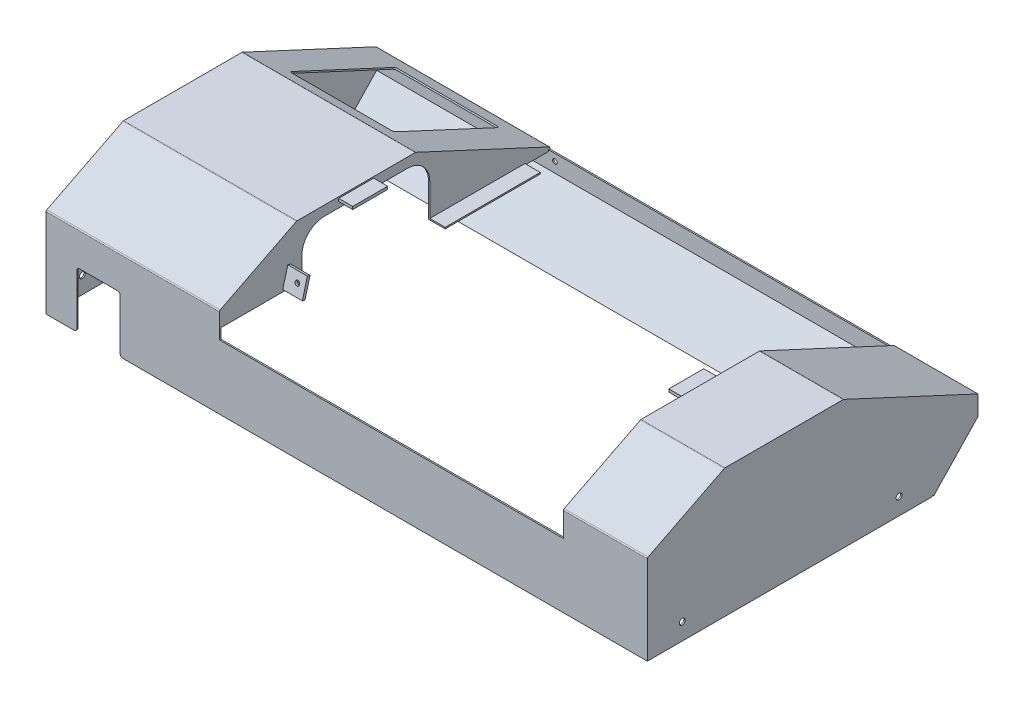
from build123d import *

# Parameters (mm, degrees)
EXTRUDE_1_DEPTH         = 215
EXTRUDE_2_DEPTH         = 1
EXTRUDE_3_DEPTH         = 1
SKETCH_4_W              = 246
SKETCH_4_H              = 137.991605588
CUT_EXTRUDE_1_DEPTH     = 333.555002245
CUT_EXTRUDE_2_REACH     = 274.801
SKETCH_5_W              = 74.6
SKETCH_5_H              = 83.6
FILLET_1_R              = 2
CUT_EXTRUDE_3_REACH     = 334.555
SKETCH_7_W              = 31
SKETCH_7_H              = 40
FILLET_2_R              = 2
FILLET_3_R              = 1
HOLE_WIZARD_M41_D       = 4.2
EXTRUDE_4_DEPTH         = 1
SKETCH_14_W             = 68
SKETCH_14_H             = 1
EXTRUDE_5_DEPTH         = 11
SKETCH_15_W             = 25
SKETCH_15_H             = 2
EXTRUDE_6_DEPTH         = 10
EXTRUDE_7_DEPTH         = 14
HOLE_WIZARD_M41_2_D     = 3.3
HOLE_WIZARD_M41_2_DEPTH = 1
HOLE_WIZARD_M42_D       = 3.3
HOLE_WIZARD_M42_DEPTH   = 2


with BuildPart() as part:
    # Эскиз1 → Бобышка-Вытянуть1 (new, symmetric)
    with BuildSketch(Plane(origin=(0, 0, 0), x_dir=(0, 0, -1), z_dir=(1, 0, 0))):
        Polygon((-97.817266744, 64), (-97.817266744, 0), (-96.817266744, 0), (-96.817266744, 63.385363703), (-42.261330955, 91), (42.278938578, 91), (137.622640037, 46.680562515), (137.622640037, 33.718332981), (106.182733256, 0.68946939), (106.907048077, 0), (138.622640037, 33.318481758), (138.622640037, 47.318481758), (42.5, 92), (-42.5, 92), align=None)
    extrude(amount=EXTRUDE_1_DEPTH, both=True)

    # Эскиз2 → Бобышка-Вытянуть2 (add)
    with BuildSketch(Plane(origin=(215, 0, 0), x_dir=(0, 0, -1), z_dir=(1, 0, 0))):
        Polygon((-96.817266744, 0), (-96.817266744, 63.385363703), (-42.261330955, 91), (42.278938578, 91), (137.622640037, 46.680562515), (137.622640037, 33.718332981), (105.526432948, 0), align=None)
    extrude(amount=-EXTRUDE_2_DEPTH)

    # Эскиз3 → Бобышка-Вытянуть3 (add)
    with BuildSketch(Plane.ZY.offset(215)):
        Polygon((96.817266744, 0), (96.817266744, 63.385363703), (42.261330955, 91), (-42.278938578, 91), (-137.622640037, 46.680562515), (-137.622640037, 33.718332981), (-105.526432948, 0), align=None)
    extrude(amount=-EXTRUDE_3_DEPTH)

    # Эскиз4 → Вырез-Вытянуть1 (cut, through all)
    with BuildSketch(Plane.XY.offset(97.817266744)):
        with Locations((32, 114.995802794)):
            Rectangle(SKETCH_4_W, SKETCH_4_H)
    extrude(amount=-CUT_EXTRUDE_1_DEPTH, mode=Mode.SUBTRACT)

    # Эскиз5 → Вырез-Вытянуть2 (cut, up to next)
    with BuildSketch(Plane(origin=(0, 91.898645501, -42.718042324), x_dir=(1, 0, 0), z_dir=(0, 0.9068173588352332, -0.42152375699964034)), mode=Mode.PRIVATE) as cut_extrude_2_sk1:
        with Locations((-153, 51.559552107)):
            Rectangle(SKETCH_5_W, SKETCH_5_H)
    cut_extrude_2_tool1 = extrude(cut_extrude_2_sk1.sketch, amount=-CUT_EXTRUDE_2_REACH, mode=Mode.PRIVATE) & part.part
    add(cut_extrude_2_tool1.solids().sort_by_distance((-153, 70.165069, -89.473139))[0], mode=Mode.SUBTRACT)

    # Скругление1
    fillet_1_edges = [part.edges().sort_by_distance(p)[0] for p in [
        (-115.7, 52.091967665, -127.167342908),
        (-115.7, 87.331353751, -51.35741171),
        (-190.3, 87.331353751, -51.35741171),
        (-190.3, 52.091967665, -127.167342908),
    ]]
    fillet(fillet_1_edges, radius=FILLET_1_R)

    # Эскиз7 → Вырез-Вытянуть3 (cut, up to next)
    with BuildSketch(Plane.XY.offset(97.817266744), mode=Mode.PRIVATE) as cut_extrude_3_sk1:
        with Locations((-177.5, 20)):
            Rectangle(SKETCH_7_W, SKETCH_7_H)
    cut_extrude_3_tool1 = extrude(cut_extrude_3_sk1.sketch, amount=-CUT_EXTRUDE_3_REACH, mode=Mode.PRIVATE) & part.part
    add(cut_extrude_3_tool1.solids().sort_by_distance((-177.5, 20, 97.817267))[0], mode=Mode.SUBTRACT)

    # Скругление2
    fillet_2_edges = [part.edges().sort_by_distance(p)[0] for p in [
        (-162, 0, 97.317266744),
        (-162, 40, 97.317266744),
        (-193, 40, 97.317266744),
        (-193, 0, 97.317266744),
    ]]
    fillet(fillet_2_edges, radius=FILLET_2_R)

    # Скругление3
    fillet_3_edges = [part.edges().sort_by_distance(p)[0] for p in [
        (-152.5, 91, -42.278938578),
        (-152.5, 91, 42.261330955),
        (-152.5, 63.385363703, 96.817266744),
        (185, 92, 42.5),
        (185, 92, -42.5),
        (0, 33.318481758, -138.622640037),
        (185, 64, 97.817266744),
        (184.5, 46.680562515, -137.622640037),
        (184.5, 91, -42.278938578),
        (184.5, 91, 42.261330955),
        (184.5, 63.385363703, 96.817266744),
        (-153, 92, 42.5),
        (-153, 92, -42.5),
        (-153, 47.318481758, -138.622640037),
        (-153, 64, 97.817266744),
    ]]
    fillet(fillet_3_edges, radius=FILLET_3_R)

    # Hole Wizard M41 (through all)
    with Locations(Plane.ZY.offset(215)):
        with Locations((72.817266744, 12), (-82.182733256, 12)):
            Hole(HOLE_WIZARD_M41_D / 2)

    # Эскиз13 → Бобышка-Вытянуть4 (add)
    with BuildSketch(Plane(origin=(-91, 0, 0), x_dir=(0, 0, -1), z_dir=(1, 0, 0))):
        with BuildLine():
            Line((137.622640037, 45), (137.622640037, 46.680562515))
            Line((137.622640037, 46.680562515), (42.278938578, 91))
            Line((42.278938578, 91), (-42.261330955, 91))
            Line((-42.261330955, 91), (-96.817266744, 63.385363703))
            Line((-96.817266744, 63.385363703), (-96.817266744, 53))
            Line((-96.817266744, 53), (-38.817266744, 53))
            Line((-38.817266744, 53), (-38.817266744, 69))
            ThreePointArc((-38.817266744, 69), (-34.130975243, 80.313708499), (-22.817266744, 85))
            Line((-22.817266744, 85), (36.622640037, 85))
            ThreePointArc((36.622640037, 85), (47.936348536, 80.313708499), (52.622640037, 69))
            Line((52.622640037, 69), (52.622640037, 45))
            Line((52.622640037, 45), (137.622640037, 45))
        make_face()
    extrude_4 = extrude(amount=-EXTRUDE_4_DEPTH)

    # Эскиз14 → Бобышка-Вытянуть5 (add)
    with BuildSketch(Plane(origin=(-91, 0, 0), x_dir=(0, 0, -1), z_dir=(1, 0, 0))):
        with Locations((86.622640037, 45.5)):
            Rectangle(SKETCH_14_W, SKETCH_14_H)
    extrude_5 = extrude(amount=EXTRUDE_5_DEPTH)

    # Эскиз15 → Бобышка-Вытянуть6 (add)
    with BuildSketch(Plane(origin=(-91, 0, 0), x_dir=(0, 0, -1), z_dir=(1, 0, 0))):
        with Locations((0.008803811, 90)):
            Rectangle(SKETCH_15_W, SKETCH_15_H)
    extrude_6 = extrude(amount=EXTRUDE_6_DEPTH)

    # Эскиз16 → Бобышка-Вытянуть7 (add)
    with BuildSketch(Plane(origin=(-91, 0, 0), x_dir=(0, 0, -1), z_dir=(1, 0, 0))):
        Polygon((-52.529527952, 54.51763809), (-48.906061321, 68.040599658), (-46.974209668, 67.522961568), (-50.5976763, 54), align=None)
    extrude_7 = extrude(amount=EXTRUDE_7_DEPTH)

    # Зеркальное отражение1: Бобышка-Вытянуть4, Бобышка-Вытянуть5, Бобышка-Вытянуть6, Бобышка-Вытянуть7 across plane
    add(extrude_4.mirror(Plane(origin=(32, 0, 0), x_dir=(0, 0, 1), z_dir=(1, 0, 0))))
    add(extrude_5.mirror(Plane(origin=(32, 0, 0), x_dir=(0, 0, 1), z_dir=(1, 0, 0))))
    add(extrude_6.mirror(Plane(origin=(32, 0, 0), x_dir=(0, 0, 1), z_dir=(1, 0, 0))))
    add(extrude_7.mirror(Plane(origin=(32, 0, 0), x_dir=(0, 0, 1), z_dir=(1, 0, 0))))

    # Hole Wizard M41 2
    with Locations(Plane(origin=(0, 0, -138.622640037), x_dir=(-1, 0, 0), z_dir=(0, 0, -1))):
        with Locations((-150.5, 41), (86.5, 41)):
            Hole(HOLE_WIZARD_M41_2_D / 2, depth=HOLE_WIZARD_M41_2_DEPTH)

    # Отверстие обработанное метчиком M42
    with Locations(Plane(origin=(0, 16.784371263, 62.640126326), x_dir=(1, 0, 0), z_dir=(0, 0.2588190451025141, 0.9659258262890702))):
        with Locations((-82.5, 46.563730151), (146.5, 46.563730151)):
            Hole(HOLE_WIZARD_M42_D / 2, depth=HOLE_WIZARD_M42_DEPTH)


solid = part.part
